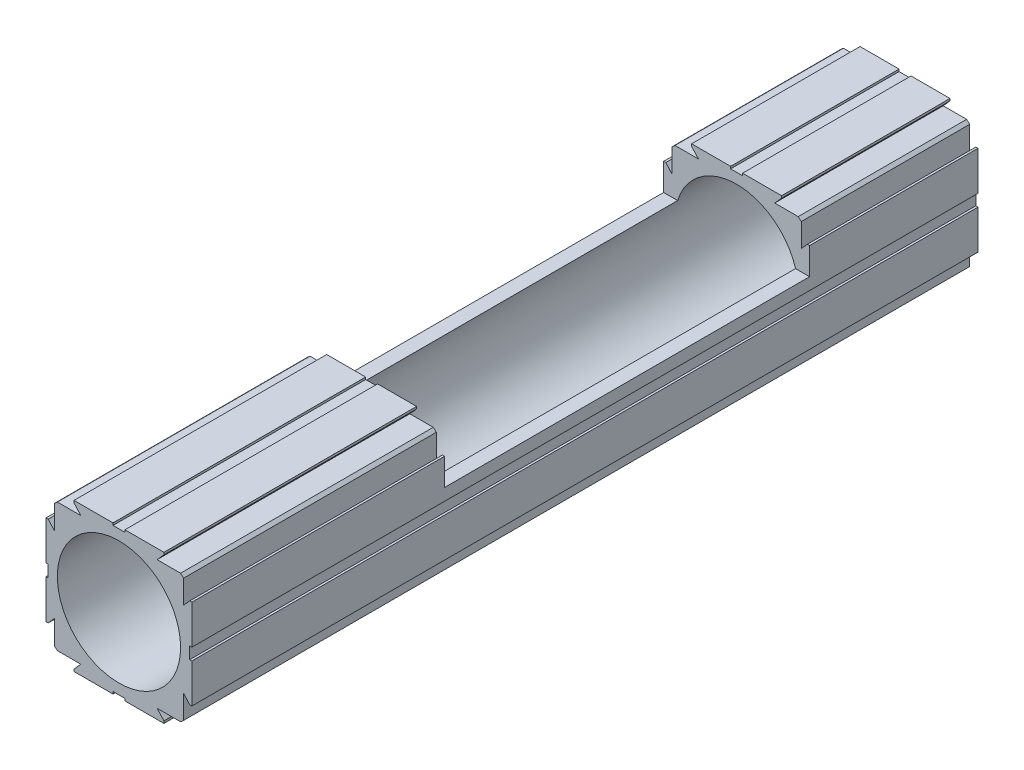
from build123d import *

# Parameters (mm, degrees)
SKETCH2_R               = 27.873868368
BOSS_EXTRUDE1_DEPTH     = 500
CUT_EXTRUDE1_DEPTH      = 505.976972678
CUT_EXTRUDE1_DEPTH_BACK = 505.976972678
SKETCH3_W               = 165.1
SKETCH3_H               = 25.4
SKETCH3_W_2             = 144.4
SKETCH3_H_2             = 67.058155704


with BuildPart() as part:
    # Sketch2 → Boss-Extrude1 (new body)
    with BuildSketch(Plane.XY):
        Polygon((-20.337957043, 33.529077852), (-2.699269284, 33.529077852), (-2.699269284, 32.535153464), (2.699269284, 32.535153464), (2.699269284, 33.529077852), (20.337957043, 33.529077852), (20.337957043, 32.535153464), (17.271526495, 29.113021938), (27.871192843, 29.113021938), (29.262123018, 27.866666927), (29.262123018, 17.267000578), (32.013880115, 20.337957043), (33.007804503, 20.337957043), (33.007804503, 2.699269284), (32.013880115, 2.699269284), (32.013880115, -2.699269284), (33.007804503, -2.699269284), (33.007804503, -20.337957043), (32.013880115, -20.337957043), (29.262123018, -17.267000578), (29.262123018, -27.866666927), (27.871192843, -29.113021938), (17.271526495, -29.113021938), (20.337957043, -32.535153464), (20.337957043, -33.529077852), (2.699269284, -33.529077852), (2.699269284, -32.535153464), (-2.699269284, -32.535153464), (-2.699269284, -33.529077852), (-20.337957043, -33.529077852), (-20.337957043, -32.535153464), (-17.271526495, -29.113021938), (-27.871192843, -29.113021938), (-29.262123018, -27.866666927), (-29.262123018, -17.267000578), (-32.013880115, -20.337957043), (-33.007804503, -20.337957043), (-33.007804503, -2.699269284), (-32.013880115, -2.699269284), (-32.013880115, 2.699269284), (-33.007804503, 2.699269284), (-33.007804503, 20.337957043), (-32.013880115, 20.337957043), (-29.262123018, 17.267000578), (-29.262123018, 27.866666927), (-27.871192843, 29.113021938), (-17.271526495, 29.113021938), (-20.337957043, 32.535153464), align=None)
        Circle(SKETCH2_R, mode=Mode.SUBTRACT)
    extrude(amount=BOSS_EXTRUDE1_DEPTH)

    # Sketch3 → Cut-Extrude1 (cut, two sides: drawn at the far end of the back side and taken through both)
    with BuildSketch(Plane(origin=(29.262123018, 0, 0), x_dir=(0, 0, -1), z_dir=(1, 0, 0)).offset(-CUT_EXTRUDE1_DEPTH_BACK)):
        with Locations((-303.15, 20.829077852)):
            Rectangle(SKETCH3_W, SKETCH3_H)
        with Locations((-72.2, 0)):
            Rectangle(SKETCH3_W_2, SKETCH3_H_2)
    extrude(amount=CUT_EXTRUDE1_DEPTH + CUT_EXTRUDE1_DEPTH_BACK, mode=Mode.SUBTRACT)


solid = part.part
